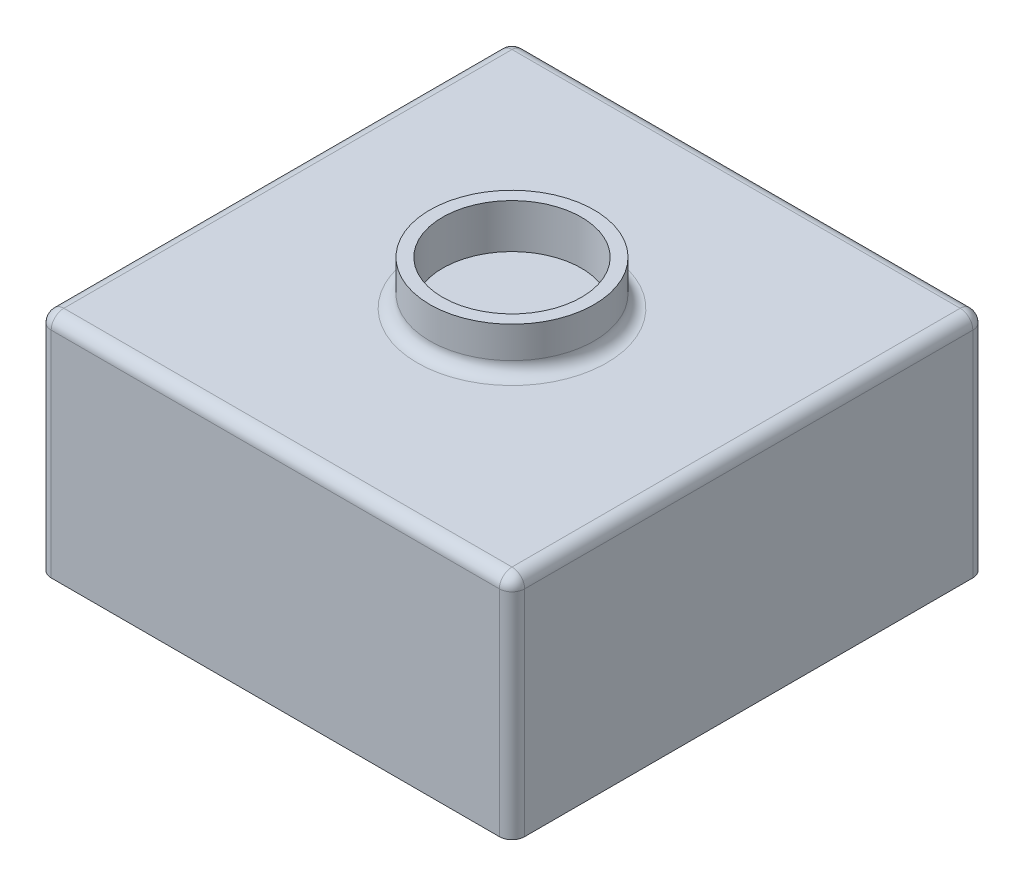
from build123d import *

# Parameters (mm, degrees)
SKETCH1_W           = 375
SKETCH1_H           = 375
BOSS_EXTRUDE1_DEPTH = 180
SKETCH2_R           = 65
BOSS_EXTRUDE2_DEPTH = 35
SKETCH3_R           = 55
CUT_EXTRUDE1_DEPTH  = 35
FILLET1_R           = 10
FILLET2_R           = 10


with BuildPart() as part:
    # Sketch1 → Boss-Extrude1 (new body)
    with BuildSketch(Plane(origin=(0, 0, 0), x_dir=(1, 0, 0), z_dir=(0, 1, 0))):
        Rectangle(SKETCH1_W, SKETCH1_H)
    extrude(amount=BOSS_EXTRUDE1_DEPTH)

    # Sketch2 → Boss-Extrude2 (add)
    with BuildSketch(Plane(origin=(0, 180, 0), x_dir=(1, 0, 0), z_dir=(0, 1, 0))):
        with Locations(Location((0, 0, 0), (0, 0, 270))):
            Circle(SKETCH2_R)
    extrude(amount=BOSS_EXTRUDE2_DEPTH)

    # Sketch3 → Cut-Extrude1 (cut)
    with BuildSketch(Plane(origin=(0, 215, 0), x_dir=(1, 0, 0), z_dir=(0, 1, 0))):
        with Locations(Location((0, 0, 0), (0, 0, 270))):
            Circle(SKETCH3_R)
    extrude(amount=-CUT_EXTRUDE1_DEPTH, mode=Mode.SUBTRACT)

    # Fillet1
    fillet1_edges = [part.edges().sort_by_distance(p)[0] for p in [
        (0, 180, -65),
    ]]
    fillet(fillet1_edges, radius=FILLET1_R)

    # Fillet2
    fillet2_edges = [part.edges().sort_by_distance(p)[0] for p in [
        (187.5, 180, 0),
        (0, 180, -187.5),
        (-187.5, 180, 0),
        (-187.5, 90, -187.5),
        (187.5, 90, -187.5),
        (187.5, 90, 187.5),
        (-187.5, 90, 187.5),
        (0, 180, 187.5),
    ]]
    fillet(fillet2_edges, radius=FILLET2_R)


solid = part.part
